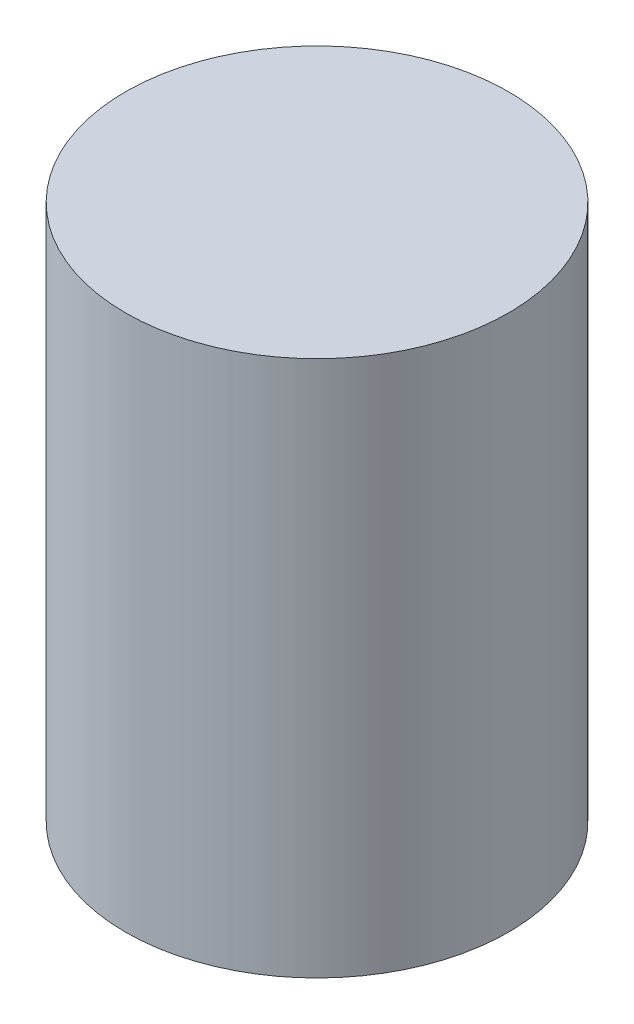
from build123d import *

# Parameters (mm, degrees)
PACK_VAKUM_TANKI_1L_D100_START = 300
SKETCH1_R                      = 50
PACK_VAKUM_TANKI_1L_D100_DEPTH = 140


with BuildPart() as part:
    # Sketch1 → PACK_vakum_tanki_1L_D100 (new body)
    with BuildSketch(Plane(origin=(0, 0, 0), x_dir=(1, 0, 0), z_dir=(0, 1, 0)).offset(PACK_VAKUM_TANKI_1L_D100_START)):
        with Locations(Location((150, 650, 0), (0, 0, 270))):
            Circle(SKETCH1_R)
    extrude(amount=PACK_VAKUM_TANKI_1L_D100_DEPTH)


solid = part.part
